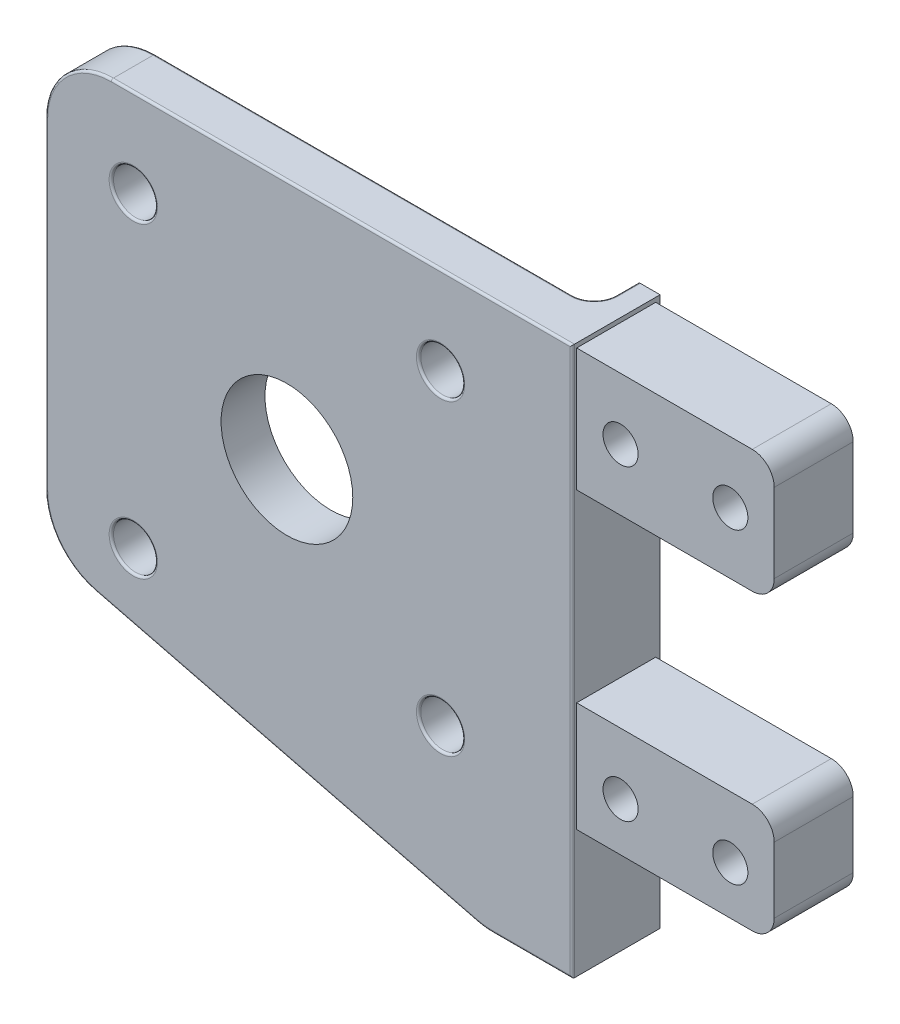
from build123d import *

# Parameters (mm, degrees)
SKETCH1_R                = 5
BOSS_EXTRUDE1_DEPTH      = 5
BOSS_EXTRUDE2_DEPTH      = 4
BOSS_EXTRUDE2_DEPTH_BACK = 14
SKETCH1_3_W              = 45
SKETCH1_3_H              = 25
SKETCH1_3_R              = 4
SKETCH2_W                = 5
SKETCH2_H                = 125
BOSS_EXTRUDE3_DEPTH      = 10
FILLET1_R                = 5
FILLET2_R                = 15
FILLET3_R                = 0.5
CUT_EXTRUDE1_REACH       = 138.771
SKETCH3_R                = 15


with BuildPart() as part:
    # Sketch1 → Boss-Extrude1 (new, symmetric)
    with BuildSketch(Plane.XY):
        Polygon((-120, -37.5), (-120, 62.5), (0, 62.5), (0, -62.5), (-20, -62.5), align=None)
        with Locations((-30, -27.5)):
            Circle(SKETCH1_R, mode=Mode.SUBTRACT)
        with Locations((-100, -27.5)):
            Circle(SKETCH1_R, mode=Mode.SUBTRACT)
        with Locations((-30, 42.5)):
            Circle(SKETCH1_R, mode=Mode.SUBTRACT)
        with Locations((-100, 42.5)):
            Circle(SKETCH1_R, mode=Mode.SUBTRACT)
    extrude(amount=BOSS_EXTRUDE1_DEPTH, both=True)

    # Sketch1<3> → Boss-Extrude2 (add, two sides: drawn at the far end of the back side and taken through both)
    # profile 1 of 3: a face of its own
    with BuildSketch(Plane.XY.offset(-BOSS_EXTRUDE2_DEPTH_BACK)):
        with BuildLine():
            Line((45, 61.5), (0, 61.5))
            Line((0, 61.5), (0, 47.5))
            Line((0, 47.5), (6, 47.5))
            ThreePointArc((6, 47.5), (10, 51.5), (14, 47.5))
            Line((14, 47.5), (31, 47.5))
            ThreePointArc((31, 47.5), (35, 51.5), (39, 47.5))
            Line((39, 47.5), (45, 47.5))
            Line((45, 47.5), (45, 61.5))
        make_face()
    # profile 2 of 3: a face of its own
    with BuildSketch(Plane.XY.offset(-BOSS_EXTRUDE2_DEPTH_BACK)):
        with BuildLine():
            Line((6, 47.5), (0, 47.5))
            Line((0, 47.5), (0, 33.5))
            Line((0, 33.5), (45, 33.5))
            Line((45, 33.5), (45, 47.5))
            Line((45, 47.5), (39, 47.5))
            ThreePointArc((39, 47.5), (35, 43.5), (31, 47.5))
            Line((31, 47.5), (14, 47.5))
            ThreePointArc((14, 47.5), (10, 43.5), (6, 47.5))
        make_face()
    # profile 3 of 3: a face of its own
    with BuildSketch(Plane.XY.offset(-BOSS_EXTRUDE2_DEPTH_BACK)):
        with Locations((22.5, -21)):
            Rectangle(SKETCH1_3_W, SKETCH1_3_H)
        with Locations((10, -22.5)):
            Circle(SKETCH1_3_R, mode=Mode.SUBTRACT)
        with Locations((35, -22.5)):
            Circle(SKETCH1_3_R, mode=Mode.SUBTRACT)
    extrude(amount=BOSS_EXTRUDE2_DEPTH + BOSS_EXTRUDE2_DEPTH_BACK)

    # Sketch2 → Boss-Extrude3 (add)
    with BuildSketch(Plane(origin=(0, 0, -5), x_dir=(-1, 0, 0), z_dir=(0, 0, -1))):
        with Locations((2.5, 0)):
            Rectangle(SKETCH2_W, SKETCH2_H)
    extrude(amount=BOSS_EXTRUDE3_DEPTH)

    # Fillet1
    fillet1_edges = [part.edges().sort_by_distance(p)[0] for p in [
        (45, 61.5, -5),
        (45, 33.5, -5),
        (45, -33.5, -5),
        (45, -8.5, -5),
        (-5, 0, -5),
    ]]
    fillet(fillet1_edges, radius=FILLET1_R)

    # Fillet2
    fillet2_edges = [part.edges().sort_by_distance(p)[0] for p in [
        (-120, 62.5, 0),
        (-20, -62.5, 0),
        (-120, -37.5, 0),
    ]]
    fillet(fillet2_edges, radius=FILLET2_R)

    # Fillet3
    fillet3_edges = [part.edges().sort_by_distance(p)[0] for p in [
        (-57.5, 62.5, -5),
        (-65.214742183, -51.196314454, -5),
        (-120, 10.855823048, -5),
        (-115.606601718, 58.106601718, -5),
        (-116.82308157, -35.019537045, -5),
        (-19.986164571, -62.38761335, -5),
        (-65.214742183, -51.196314454, 5),
        (-120, 10.855823048, 5),
        (-52.5, 62.5, 5),
        (-115.606601718, 58.106601718, 5),
        (-116.82308157, -35.019537045, 5),
        (-19.986164571, -62.38761335, 5),
        (-105, -27.5, 5),
        (-105, 42.5, -5),
        (-35, 42.5, -5),
        (-105, -27.5, -5),
        (-35, -27.5, -5),
        (-35, 42.5, 5),
        (-105, 42.5, 5),
        (-9.076707808, -62.5, 5),
        (0, 0, 5),
        (-5, -62.5, -12.5),
        (-5, 62.5, -12.5),
        (-35, -27.5, 5),
        (-14.076707808, -62.5, -5),
        (-6.464466094, 62.5, -6.464466094),
        (-6.464466094, -62.5, -6.464466094),
    ]]
    fillet(fillet3_edges, radius=FILLET3_R)

    # Sketch3 → Cut-Extrude1 (cut, up to next)
    with BuildSketch(Plane.XY.offset(5), mode=Mode.PRIVATE) as cut_extrude1_sk1:
        with Locations((-65, 7.5)):
            Circle(SKETCH3_R)
    cut_extrude1_tool1 = extrude(cut_extrude1_sk1.sketch, amount=-CUT_EXTRUDE1_REACH, mode=Mode.PRIVATE) & part.part
    add(cut_extrude1_tool1.solids().sort_by_distance((-65, 7.5, 5))[0], mode=Mode.SUBTRACT)


solid = part.part
